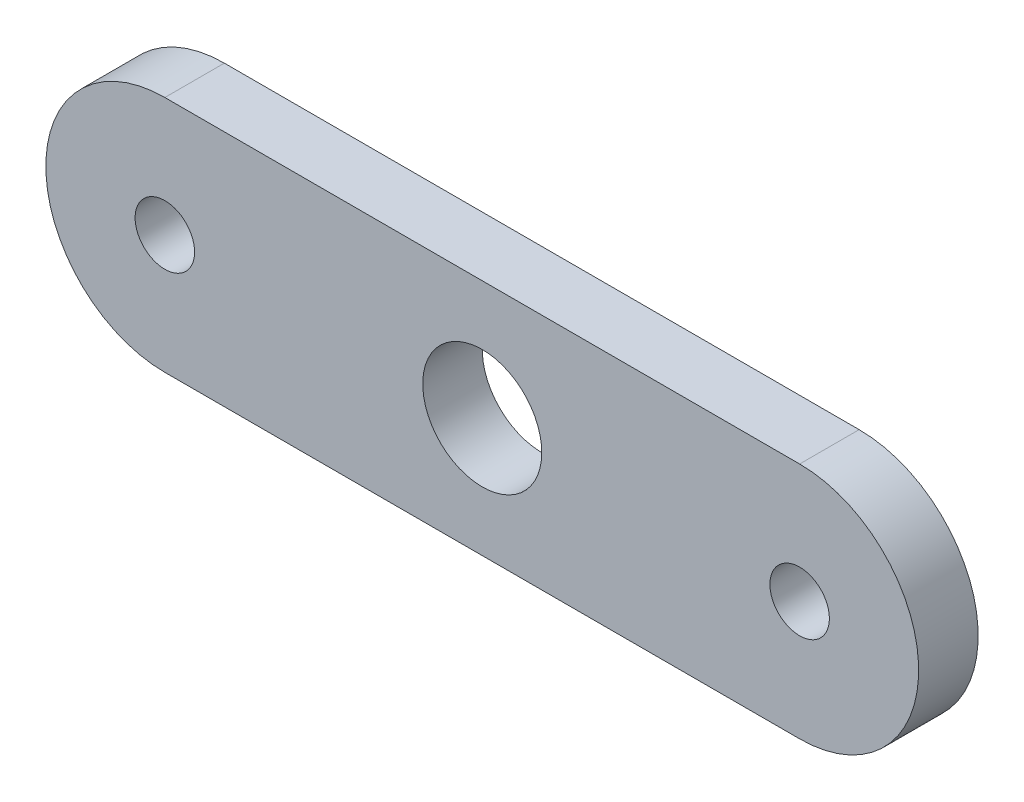
from build123d import *

# Parameters (mm, degrees)
SKETCH1_R           = 1.5
SKETCH1_R_2         = 3
BOSS_EXTRUDE1_DEPTH = 3


with BuildPart() as part:
    # Sketch1 → Boss-Extrude1 (new body)
    with BuildSketch(Plane.XY):
        with BuildLine():
            Line((0, 6), (32, 6))
            ThreePointArc((32, 6), (38, 0), (32, -6))
            Line((32, -6), (0, -6))
            ThreePointArc((0, -6), (-6, 0), (0, 6))
        make_face()
        Circle(SKETCH1_R, mode=Mode.SUBTRACT)
        with Locations((32, 0)):
            Circle(SKETCH1_R, mode=Mode.SUBTRACT)
        with Locations((16, 0)):
            Circle(SKETCH1_R_2, mode=Mode.SUBTRACT)
    extrude(amount=BOSS_EXTRUDE1_DEPTH)


solid = part.part
